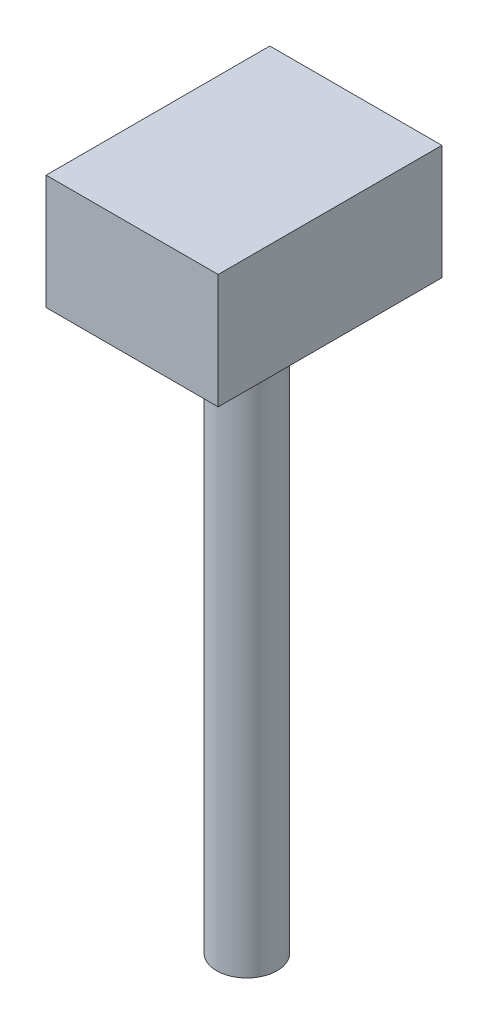
from build123d import *

# Parameters (mm, degrees)
SKETCH6_W           = 300
SKETCH6_H           = 200
BOSS_EXTRUDE2_DEPTH = 400
SKETCH7_W           = 280
SKETCH7_H           = 190
CUT_EXTRUDE1_DEPTH  = 390
SKETCH8_R           = 52.806459668
BOSS_EXTRUDE3_DEPTH = 1000
SKETCH9_R           = 3.5
CUT_EXTRUDE3_DEPTH  = 5
CUT_EXTRUDE4_REACH  = 1113.602
SKETCH10_W          = 300
SKETCH10_H          = 10


with BuildPart() as part:
    # Sketch6 → Boss-Extrude2 (new body)
    with BuildSketch(Plane.XY):
        with Locations((125.060423937, -72.070983455)):
            Rectangle(SKETCH6_W, SKETCH6_H)
    extrude(amount=BOSS_EXTRUDE2_DEPTH)

    # Sketch7 → Cut-Extrude1 (cut)
    with BuildSketch(Plane(origin=(0, 0, 0), x_dir=(-1, 0, 0), z_dir=(0, 0, -1))):
        with Locations((-125.060423937, -72.070983455)):
            Rectangle(SKETCH7_W, SKETCH7_H)
    extrude(amount=-CUT_EXTRUDE1_DEPTH, mode=Mode.SUBTRACT)

    # Sketch8 → Boss-Extrude3 (add)
    with BuildSketch(Plane.XZ.offset(172.070983455)):
        with Locations(Location((125.060423937, 200, 0), (0, 0, 270))):
            Circle(SKETCH8_R)
    extrude(amount=BOSS_EXTRUDE3_DEPTH)

    # Sketch9 → Cut-Extrude3 (cut)
    with BuildSketch(Plane.XZ.offset(172.070983455)):
        with Locations(Location((45.060423937, 15, 0), (0, 0, 270))):
            Circle(SKETCH9_R)
        with Locations(Location((205.060423937, 15, 0), (0, 0, 270))):
            Circle(SKETCH9_R)
    extrude(amount=-CUT_EXTRUDE3_DEPTH, mode=Mode.SUBTRACT)

    # Cut-Extrude4: up to this face of the body (flat: up to its plane)
    cut_extrude4_end = Plane(part.part.faces().sort_by_distance((125.060423937, 27.929016545, 200))[0])
    # Sketch10 → Cut-Extrude4 (cut, up to the picked face)
    with BuildSketch(Plane.XZ.offset(172.070983455), mode=Mode.PRIVATE) as cut_extrude4_sk1:
        with Locations((125.060423937, 5)):
            Rectangle(SKETCH10_W, SKETCH10_H)
    cut_extrude4_tool1 = split(extrude(cut_extrude4_sk1.sketch, amount=-CUT_EXTRUDE4_REACH, mode=Mode.PRIVATE), bisect_by=cut_extrude4_end, keep=Keep.BOTH, mode=Mode.PRIVATE)
    add(cut_extrude4_tool1.solids().sort_by(Axis((125.060424, -172.070983, 5), (0, 1, 0)))[0], mode=Mode.SUBTRACT)


solid = part.part
